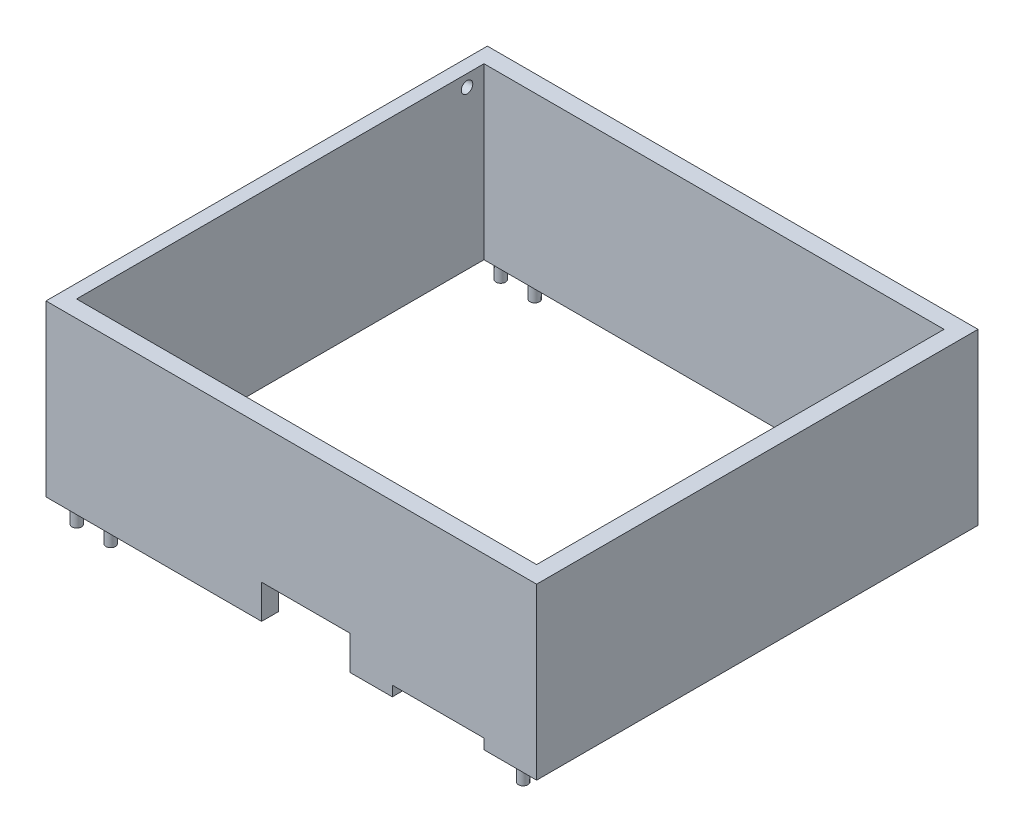
from build123d import *

# Parameters (mm, degrees)
SKETCH1_W           = 72.25
SKETCH1_H           = 65
SKETCH1_W_2         = 67.75
SKETCH1_H_2         = 60
BOSS_EXTRUDE1_DEPTH = 25
SKETCH2_W           = 13
SKETCH2_H           = 5
SKETCH2_W_2         = 13.5
SKETCH2_H_2         = 1.5
CUT_EXTRUDE1_DEPTH  = 2.5
SKETCH5_R           = 0.7
BOSS_EXTRUDE2_DEPTH = 2.5
SKETCH7_R           = 0.85
CUT_EXTRUDE3_DEPTH  = 1.25
CUT_EXTRUDE4_START  = -1.25
SKETCH8_R           = 0.85
CUT_EXTRUDE4_DEPTH  = 1.25


with BuildPart() as part:
    # Sketch1 → Boss-Extrude1 (new body)
    with BuildSketch(Plane(origin=(0, 0, 0), x_dir=(1, 0, 0), z_dir=(0, 1, 0))):
        with Locations((36.125, -32.5)):
            Rectangle(SKETCH1_W, SKETCH1_H)
        with Locations((35.875, -32.5)):
            Rectangle(SKETCH1_W_2, SKETCH1_H_2, mode=Mode.SUBTRACT)
    extrude(amount=BOSS_EXTRUDE1_DEPTH)

    # Sketch2 → Cut-Extrude1 (cut)
    with BuildSketch(Plane.XY.offset(65)):
        with Locations((38.25, 2.5)):
            Rectangle(SKETCH2_W, SKETCH2_H)
        with Locations((57.75, 0.75)):
            Rectangle(SKETCH2_W_2, SKETCH2_H_2)
    extrude(amount=-CUT_EXTRUDE1_DEPTH, mode=Mode.SUBTRACT)

    # Sketch5 → Boss-Extrude2 (add)
    with BuildSketch(Plane.XZ):
        with Locations(Location((3.25, 63.722069184, 0), (0, 0, 90))):
            Circle(SKETCH5_R)
        with Locations(Location((8.25, 63.722069184, 0), (0, 0, 90))):
            Circle(SKETCH5_R)
        with Locations(Location((3.25, 1.277930816, 0), (0, 0, 90))):
            Circle(SKETCH5_R)
        with Locations(Location((8.25, 1.277930816, 0), (0, 0, 90))):
            Circle(SKETCH5_R)
        with Locations(Location((69, 63.722069184, 0), (0, 0, 90))):
            Circle(SKETCH5_R)
        with Locations(Location((69, 1.277930816, 0), (0, 0, 90))):
            Circle(SKETCH5_R)
        with Locations(Location((64, 1.277930816, 0), (0, 0, 90))):
            Circle(SKETCH5_R)
    extrude(amount=BOSS_EXTRUDE2_DEPTH)

    # Sketch7 → Cut-Extrude3 (cut)
    with BuildSketch(Plane.ZY.offset(-69.75)):
        with Locations((5, 23.25)):
            Circle(SKETCH7_R)
    extrude(amount=-CUT_EXTRUDE3_DEPTH, mode=Mode.SUBTRACT)

    # Sketch8 → Cut-Extrude4 (cut)
    with BuildSketch(Plane(origin=(2, 0, 0), x_dir=(0, 0, -1), z_dir=(1, 0, 0)).offset(CUT_EXTRUDE4_START)):
        with Locations(Location((-5, 23.25, 0), (0, 0, 180))):
            Circle(SKETCH8_R)
    extrude(amount=CUT_EXTRUDE4_DEPTH, mode=Mode.SUBTRACT)


solid = part.part
